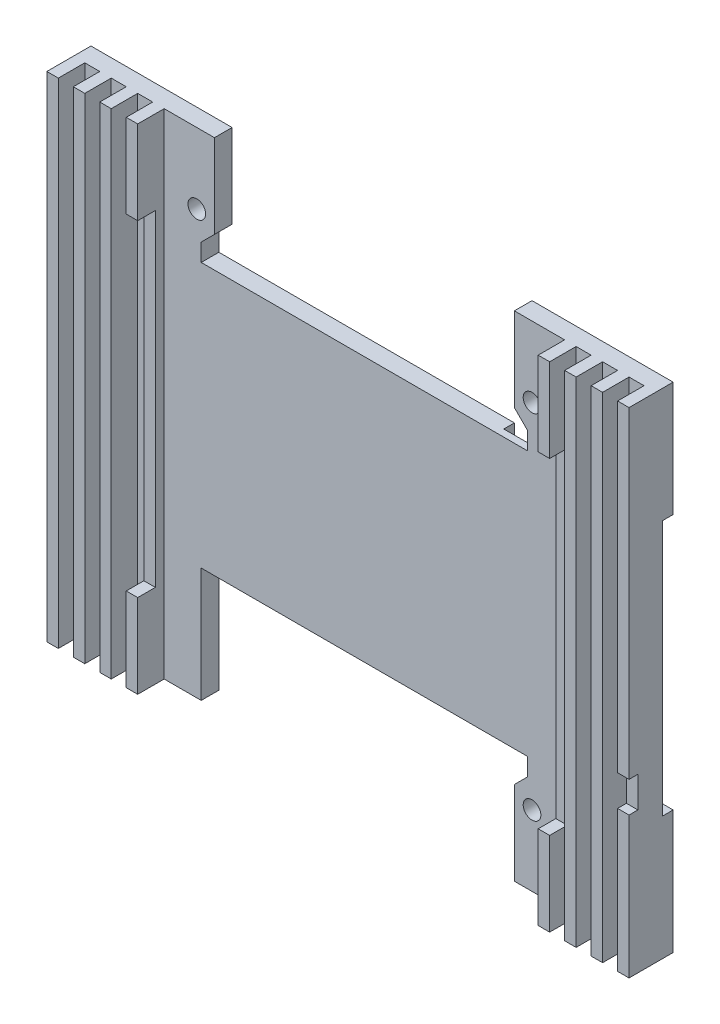
from build123d import *

# Parameters (mm, degrees)
SKETCH_1_R          = 1
EXTRUDE_1_DEPTH     = 2
SKETCH_2_W          = 1.3
SKETCH_2_H          = 56
EXTRUDE_2_DEPTH     = 3
SKETCH_3_W          = 20
SKETCH_3_H          = 14
CUT_EXTRUDE_1_DEPTH = 1.2
SKETCH_6_W          = 4.5
SKETCH_6_H          = 8
CUT_EXTRUDE_4_DEPTH = 1.2
SKETCH_4_W          = 1.3
SKETCH_4_H          = 3.5
CUT_EXTRUDE_2_DEPTH = 1
SKETCH_5_W          = 48
SKETCH_5_H          = 37
CUT_EXTRUDE_3_DEPTH = 2


with BuildPart() as part:
    # 草图1 → 凸台-拉伸1 (new body)
    with BuildSketch(Plane.XY):
        Polygon((18.5, 15), (-18.5, 15), (-18.5, 17), (-17, 18.5), (-17, 28), (-33, 28), (-33, -28), (-18.5, -28), (-18.5, -17), (-18.5, -15), (18.5, -15), (18.5, -17), (17, -18.5), (17, -28), (33, -28), (33, 28), (17, 28), (17, 18.5), (18.5, 17), align=None)
        with Locations((19, -20)):
            Circle(SKETCH_1_R, mode=Mode.SUBTRACT)
        with Locations((-19, 20)):
            Circle(SKETCH_1_R, mode=Mode.SUBTRACT)
        with Locations((19, 20)):
            Circle(SKETCH_1_R, mode=Mode.SUBTRACT)
    extrude(amount=EXTRUDE_1_DEPTH)

    # 草图2 → 凸台-拉伸2 (add)
    with BuildSketch(Plane.XY.offset(2)):
        with Locations((-32.35, 0)):
            Rectangle(SKETCH_2_W, SKETCH_2_H)
        with Locations((32.35, 0)):
            Rectangle(SKETCH_2_W, SKETCH_2_H)
        with Locations((-29.35, 0)):
            Rectangle(SKETCH_2_W, SKETCH_2_H)
        with Locations((-26.35, 0)):
            Rectangle(SKETCH_2_W, SKETCH_2_H)
        with Locations((-23.35, 0)):
            Rectangle(SKETCH_2_W, SKETCH_2_H)
        with Locations((29.35, 0)):
            Rectangle(SKETCH_2_W, SKETCH_2_H)
        with Locations((26.35, 0)):
            Rectangle(SKETCH_2_W, SKETCH_2_H)
        with Locations((23.35, 0)):
            Rectangle(SKETCH_2_W, SKETCH_2_H)
    extrude(amount=EXTRUDE_2_DEPTH)

    # 草图3 → 切除-拉伸1 (cut)
    with BuildSketch(Plane(origin=(0, 0, 0), x_dir=(-1, 0, 0), z_dir=(0, 0, -1))):
        with Locations((0, 4)):
            Rectangle(SKETCH_3_W, SKETCH_3_H)
        Polygon((-15, -3), (-15, 15), (-33, 15), (-33, -14), (-23, -14), (-23, -3), align=None)
    extrude(amount=-CUT_EXTRUDE_1_DEPTH, mode=Mode.SUBTRACT)

    # 草图6 → 切除-拉伸4 (cut)
    with BuildSketch(Plane(origin=(0, 0, 0), x_dir=(-1, 0, 0), z_dir=(0, 0, -1))):
        with Locations((27.25, -24)):
            Rectangle(SKETCH_6_W, SKETCH_6_H)
    extrude(amount=-CUT_EXTRUDE_4_DEPTH, mode=Mode.SUBTRACT)

    # 草图4 → 切除-拉伸2 (cut)
    with BuildSketch(Plane.XY.offset(5)):
        with Locations((32.35, -10.25)):
            Rectangle(SKETCH_4_W, SKETCH_4_H)
    extrude(amount=-CUT_EXTRUDE_2_DEPTH, mode=Mode.SUBTRACT)

    # 草图5 → 切除-拉伸3 (cut)
    with BuildSketch(Plane.XY.offset(5)):
        Rectangle(SKETCH_5_W, SKETCH_5_H)
    extrude(amount=-CUT_EXTRUDE_3_DEPTH, mode=Mode.SUBTRACT)


solid = part.part
